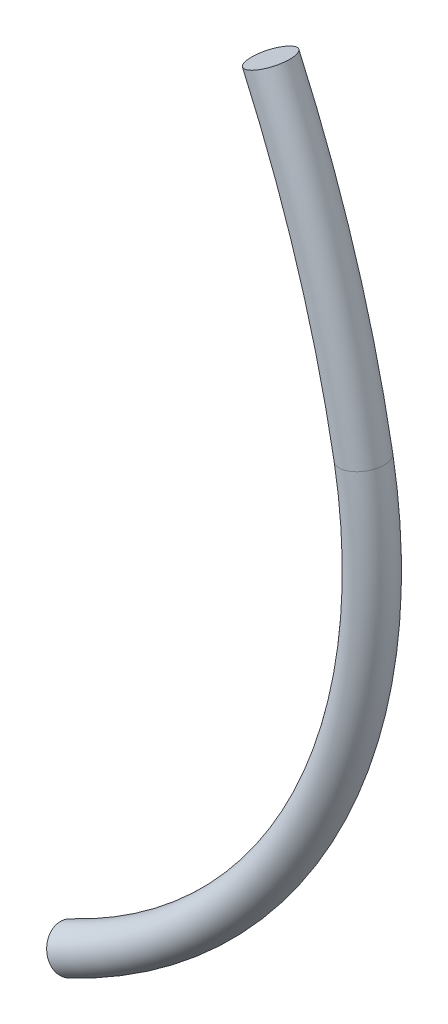
from build123d import *

# Parameters (mm, degrees)
SKETCH3_R = 50.8


with BuildPart() as part:
    # Sweep1: sweep along a path in Sketch1
    with BuildLine(Plane.XY) as sweep1_path:
        ThreePointArc((3623.908161215, -3191.198701302), (4215.351715528, -2618.372800712), (4336.742970382, -1804.002397535))
        ThreePointArc((4336.742970382, -1804.002397535), (4246.374702801, -1434.116875515), (4111.746389716, -1077.947055764))
    # Sketch3 → Sweep1 (sweep)
    with BuildSketch(Plane(origin=(1723.618209485, 817.140099, 0), x_dir=(0, 0, -1), z_dir=(0.9035979739240201, 0.4283814906370325, 0))):
        with Locations((0, -4435.975860919)):
            Circle(SKETCH3_R)
    sweep(path=sweep1_path.line)


solid = part.part
